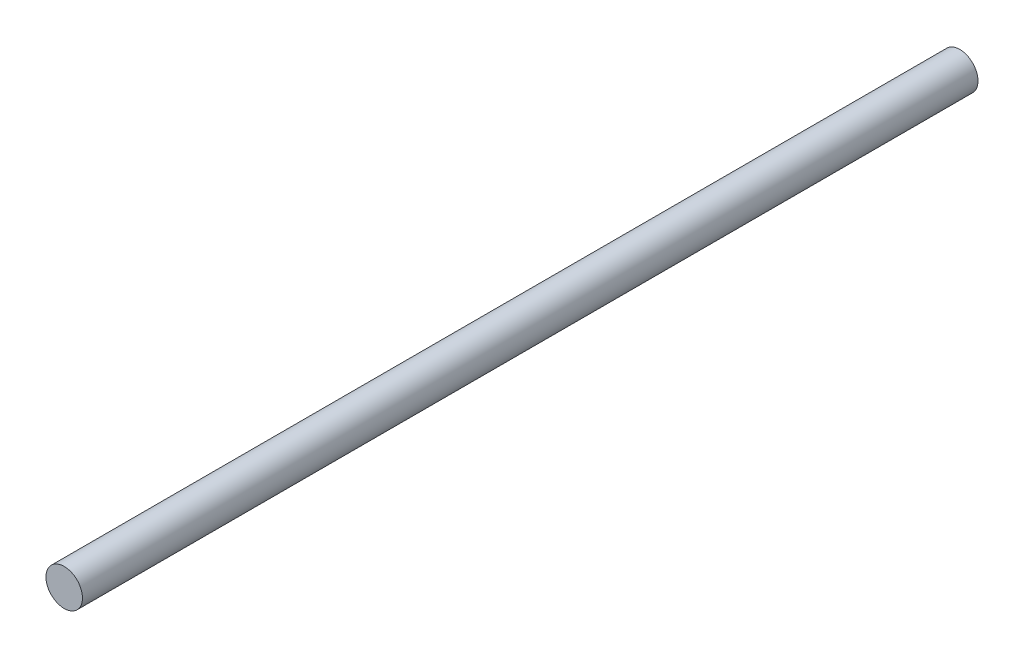
from build123d import *

# Parameters (mm, degrees)
SKETCH_1_R      = 6
EXTRUDE_1_DEPTH = 147.3


with BuildPart() as part:
    # Эскиз1 → Бобышка-Вытянуть1 (new body)
    with BuildSketch(Plane.XY):
        Circle(SKETCH_1_R)
    extrude(amount=EXTRUDE_1_DEPTH)

    # Зеркальное отражение1: part across plane


with BuildPart() as part_1:
    add(part.part)
    add(part.part.mirror(Plane.XY))


solid = part_1.part
